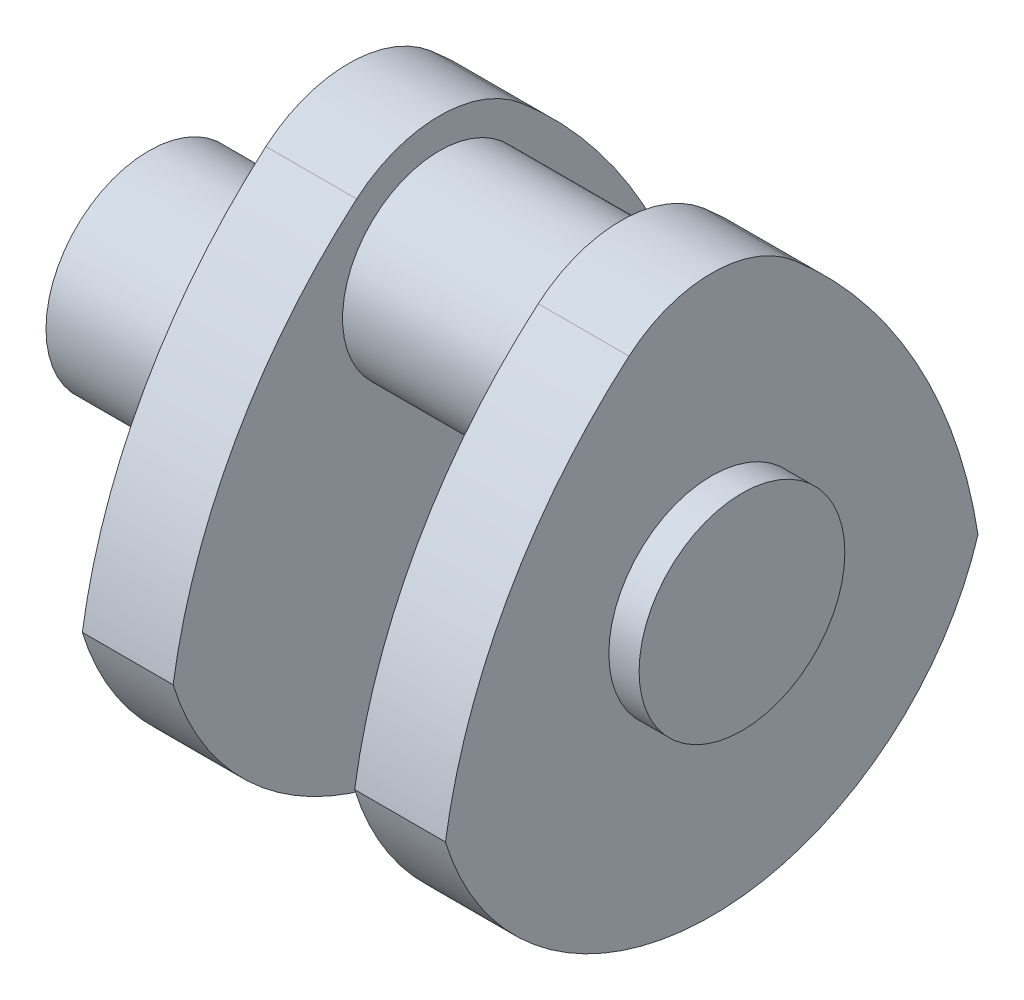
from build123d import *

# Parameters (mm, degrees)
SKETCH1_R           = 17
BOSS_EXTRUDE1_DEPTH = 25
SKETCH1_6_R         = 19
BOSS_EXTRUDE5_DEPTH = 8
BOSS_EXTRUDE6_DEPTH = 15
SKETCH4_R           = 16
BOSS_EXTRUDE7_DEPTH = 15
BOSS_EXTRUDE8_START = 5
SKETCH5_R           = 17
BOSS_EXTRUDE8_DEPTH = 5


with BuildPart() as part:
    # Sketch1 → Boss-Extrude1 (new body)
    with BuildSketch(Plane(origin=(0, 0, 0), x_dir=(0, 0, -1), z_dir=(1, 0, 0))):
        Circle(SKETCH1_R)
    extrude(amount=-BOSS_EXTRUDE1_DEPTH)

    # Sketch1<6> → Boss-Extrude5 (add)
    with BuildSketch(Plane(origin=(0, 0, 0), x_dir=(0, 0, -1), z_dir=(1, 0, 0))):
        Circle(SKETCH1_6_R)
    extrude(amount=BOSS_EXTRUDE5_DEPTH)

    # Sketch2 → Boss-Extrude6 (add)
    with BuildSketch(Plane(origin=(8, 0, 0), x_dir=(0, 0, -1), z_dir=(1, 0, 0))):
        with BuildLine():
            ThreePointArc((-13.668094758, 40.943123461), (0, 46), (13.668094758, 40.943123461))
            ThreePointArc((13.668094758, 40.943123461), (33.683444249, 16.469257624), (44, -13.416407865))
            ThreePointArc((44, -13.416407865), (0, -46), (-44, -13.416407865))
            ThreePointArc((-44, -13.416407865), (-33.683444249, 16.469257624), (-13.668094758, 40.943123461))
        make_face()
    boss_extrude6 = extrude(amount=BOSS_EXTRUDE6_DEPTH)

    # Sketch4 → Boss-Extrude7 (add)
    with BuildSketch(Plane(origin=(23, 0, 0), x_dir=(0, 0, -1), z_dir=(1, 0, 0))):
        with Locations((0, 25)):
            Circle(SKETCH4_R)
    boss_extrude7 = extrude(amount=BOSS_EXTRUDE7_DEPTH)

    # Mirror1: Boss-Extrude6, Boss-Extrude7 across plane
    add(boss_extrude6.mirror(Plane(origin=(38, 25, 0), x_dir=(0, 0, 1), z_dir=(1, 0, 0))))
    add(boss_extrude7.mirror(Plane(origin=(38, 25, 0), x_dir=(0, 0, 1), z_dir=(1, 0, 0))))

    # Sketch5 → Boss-Extrude8 (add)
    with BuildSketch(Plane(origin=(68, 0, 0), x_dir=(0, 0, -1), z_dir=(1, 0, 0)).offset(BOSS_EXTRUDE8_START)):
        Circle(SKETCH5_R)
    extrude(amount=-BOSS_EXTRUDE8_DEPTH)


solid = part.part
